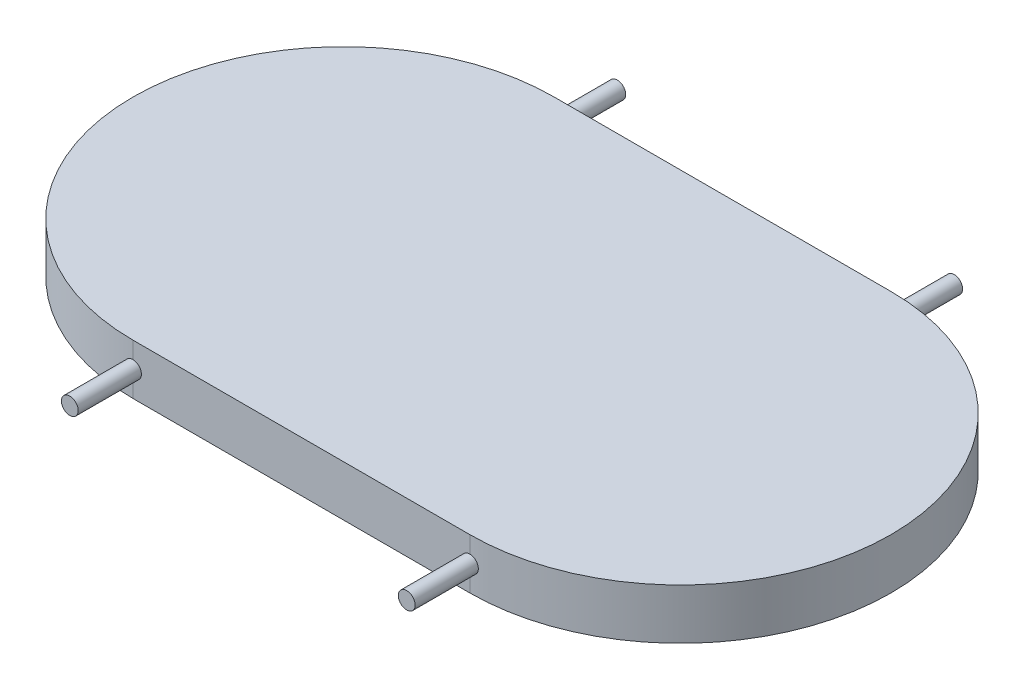
from build123d import *

# Parameters (mm, degrees)
BOSS_EXTRUDE2_DEPTH = 60
SKETCH4_R           = 10
BOSS_EXTRUDE3_DEPTH = 75
BOSS_EXTRUDE4_START = 75
SKETCH5_R           = 10
BOSS_EXTRUDE4_DEPTH = 75


with BuildPart() as part:
    # Sketch3 → Boss-Extrude2 (new body)
    with BuildSketch(Plane(origin=(0, 0, 0), x_dir=(1, 0, 0), z_dir=(0, 1, 0))):
        with BuildLine():
            Line((-200, 250), (200, 250))
            ThreePointArc((200, 250), (450, 0), (200, -250))
            Line((200, -250), (-200, -250))
            ThreePointArc((-200, -250), (-450, 0), (-200, 250))
        make_face()
    extrude(amount=BOSS_EXTRUDE2_DEPTH)

    # Sketch4 → Boss-Extrude3 (add)
    with BuildSketch(Plane.XY.offset(250)):
        with Locations(Location((-200, 30, 0), (0, 0, 270))):
            Circle(SKETCH4_R)
        with Locations(Location((200, 30, 0), (0, 0, 270))):
            Circle(SKETCH4_R)
    extrude(amount=BOSS_EXTRUDE3_DEPTH)

    # Sketch5 → Boss-Extrude4 (add)
    with BuildSketch(Plane(origin=(0, 0, -250), x_dir=(-1, 0, 0), z_dir=(0, 0, -1)).offset(BOSS_EXTRUDE4_START)):
        with Locations(Location((-200, 30, 0), (0, 0, 270))):
            Circle(SKETCH5_R)
        with Locations(Location((200, 30, 0), (0, 0, 270))):
            Circle(SKETCH5_R)
    extrude(amount=-BOSS_EXTRUDE4_DEPTH)


solid = part.part
